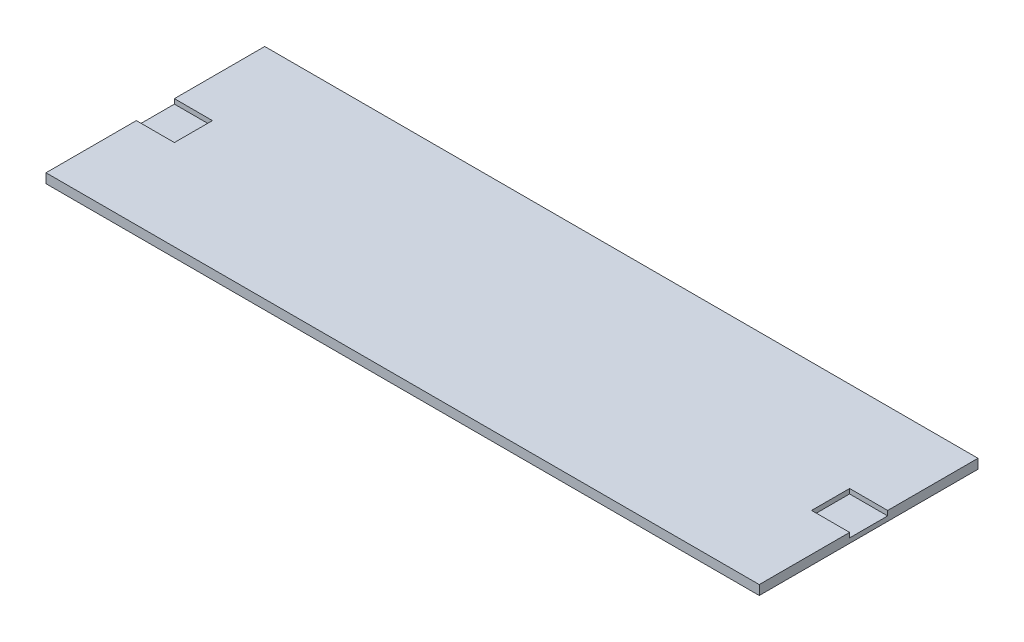
from build123d import *

# Parameters (mm, degrees)
SKETCH1_W           = 476.25
SKETCH1_H           = 146.05
BOSS_EXTRUDE1_DEPTH = 6.35
SKETCH2_W           = 25.4
SKETCH2_H           = 25.4
CUT_EXTRUDE1_DEPTH  = 3.175


with BuildPart() as part:
    # Sketch1 → Boss-Extrude1 (new body)
    with BuildSketch(Plane(origin=(0, 0, 0), x_dir=(1, 0, 0), z_dir=(0, 1, 0))):
        with Locations((149.003927171, -17.29107535)):
            Rectangle(SKETCH1_W, SKETCH1_H)
    extrude(amount=BOSS_EXTRUDE1_DEPTH)

    # Sketch2 → Cut-Extrude1 (cut)
    with BuildSketch(Plane(origin=(0, 6.35, 0), x_dir=(1, 0, 0), z_dir=(0, 1, 0))):
        with Locations((-76.421072829, -17.29107535)):
            Rectangle(SKETCH2_W, SKETCH2_H)
        with Locations((374.428927171, -17.29107535)):
            Rectangle(SKETCH2_W, SKETCH2_H)
    extrude(amount=-CUT_EXTRUDE1_DEPTH, mode=Mode.SUBTRACT)


solid = part.part
